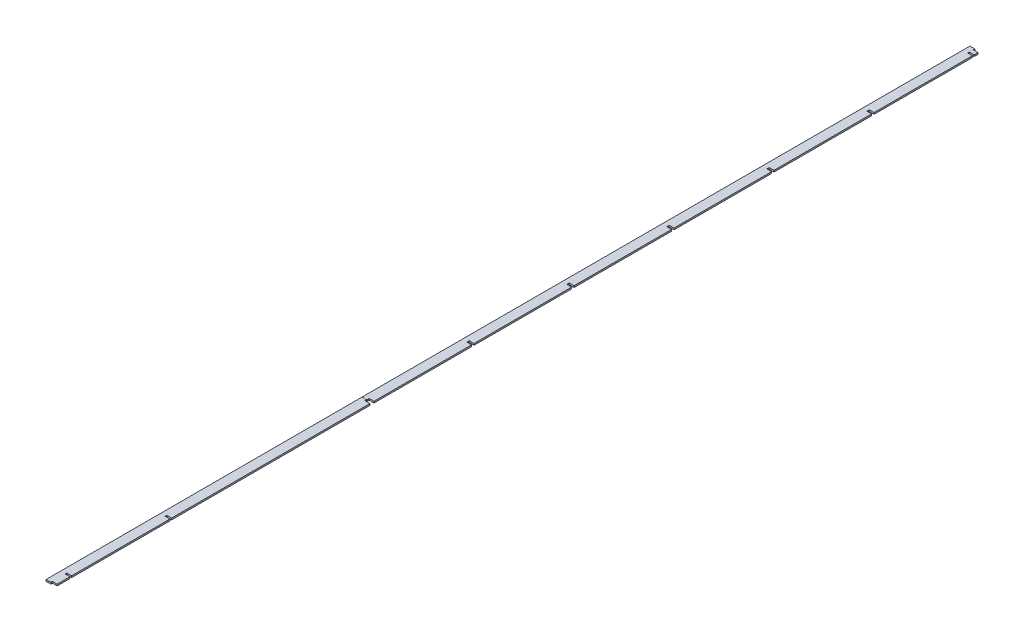
from build123d import *

# Parameters (mm, degrees)
SKETCH_1_W          = 12
SKETCH_1_H          = 2
EXTRUDE_1_DEPTH     = 1155
SKETCH_3_W          = 6
SKETCH_3_H          = 2
SKETCH_3_H_2        = 3
CUT_EXTRUDE_1_DEPTH = 1164.113232196


with BuildPart() as part:
    # 草图1 → 凸台-拉伸1 (new body)
    with BuildSketch(Plane.XY):
        with Locations((-131.125456821, -6.301880905)):
            Rectangle(SKETCH_1_W, SKETCH_1_H)
    extrude(amount=EXTRUDE_1_DEPTH)

    # 草图3 → 切除-拉伸1 (cut, through all)
    with BuildSketch(Plane(origin=(0, -5.301880905, 0), x_dir=(1, 0, 0), z_dir=(0, 1, 0))):
        with Locations((-128.125456821, -1)):
            Rectangle(SKETCH_3_W, SKETCH_3_H)
        with Locations((-128.125456821, -8)):
            Rectangle(SKETCH_3_W, SKETCH_3_H)
        with Locations((-128.125456821, -258.5)):
            Rectangle(SKETCH_3_W, SKETCH_3_H_2)
        with Locations((-128.125456821, -133.5)):
            Rectangle(SKETCH_3_W, SKETCH_3_H_2)
        with Locations((-128.125456821, -383.5)):
            Rectangle(SKETCH_3_W, SKETCH_3_H_2)
        with Locations((-128.125456821, -508.5)):
            Rectangle(SKETCH_3_W, SKETCH_3_H_2)
        with Locations((-128.125456821, -633.5)):
            Rectangle(SKETCH_3_W, SKETCH_3_H_2)
        Polygon((-125.125456821, -760), (-125.125456821, -757), (-131.125456821, -757), (-131.125456821, -759.9), (-137.125456821, -759.9), (-137.125456821, -760.1), (-131.125456821, -760.1), (-131.125456821, -762), (-125.125456821, -762), align=None)
        with Locations((-128.125456821, -1011)):
            Rectangle(SKETCH_3_W, SKETCH_3_H)
        with Locations((-128.125456821, -1136)):
            Rectangle(SKETCH_3_W, SKETCH_3_H)
        with Locations((-128.125456821, -1154)):
            Rectangle(SKETCH_3_W, SKETCH_3_H)
    extrude(amount=-CUT_EXTRUDE_1_DEPTH, mode=Mode.SUBTRACT)


with BuildPart() as cut_extrude_1_piece_1:
    # of the separate pieces the step leaves, piece 1, a body of its own (cut_extrude_1_pieces)
    add(part.part.solids().sort_by_distance((-137.125456821, -5.301880905, 0))[0])


with BuildPart() as cut_extrude_1_piece_2:
    # of the separate pieces the step leaves, piece 2, a body of its own (cut_extrude_1_pieces)
    add(part.part.solids().sort_by_distance((-137.125456821, -5.301880905, 760.1))[0])


solid = Compound([cut_extrude_1_piece_1.part, cut_extrude_1_piece_2.part])
